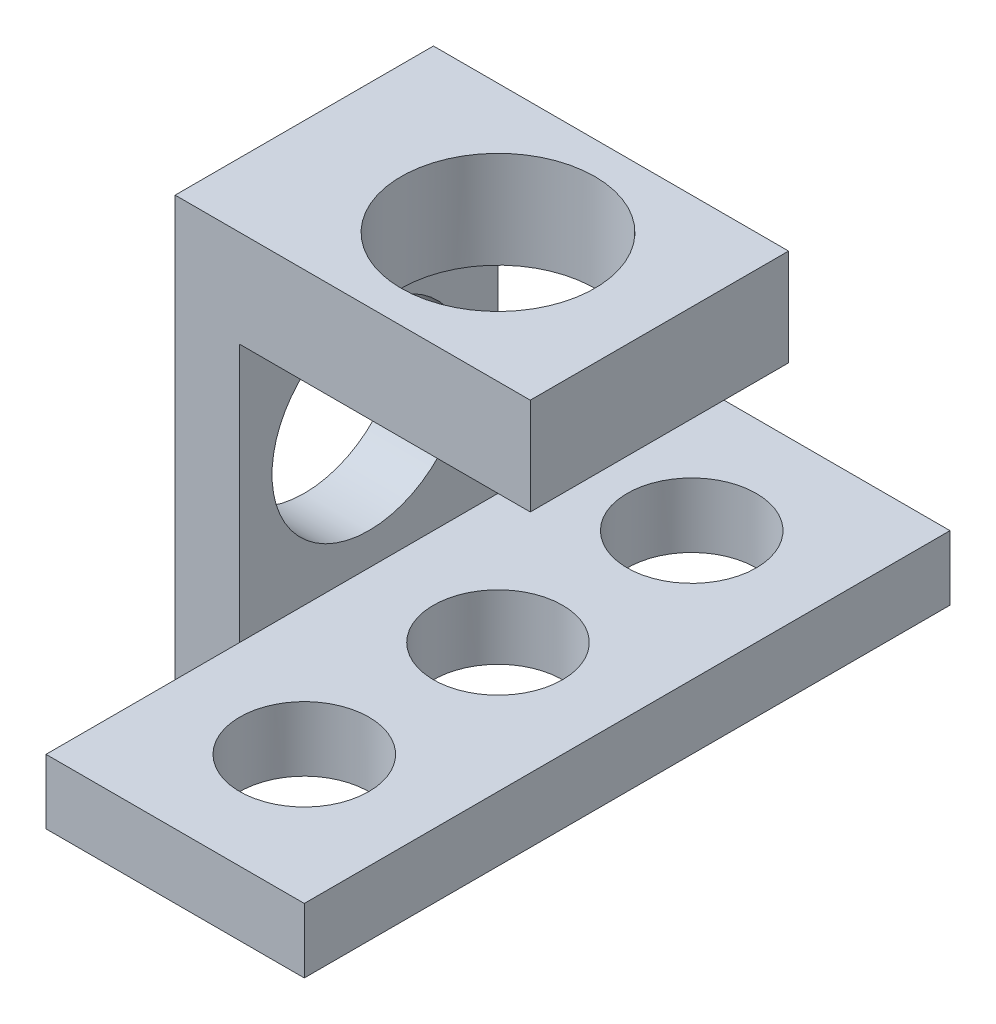
from build123d import *

# Parameters (mm, degrees)
BOSS_EXTRUDE3_DEPTH      = 20
BOSS_EXTRUDE3_DEPTH_BACK = 20
BOSS_EXTRUDE4_DEPTH      = 50
BOSS_EXTRUDE4_DEPTH_BACK = 50
SKETCH1_5_W              = 40
SKETCH1_5_H              = 10
CUT_EXTRUDE2_REACH       = 100.742
SKETCH4_R                = 15
CUT_EXTRUDE3_REACH       = 98.047
SKETCH5_R                = 15
CUT_EXTRUDE4_REACH       = 98.047
SKETCH6_R                = 10


with BuildPart() as part:
    # Sketch1 → Boss-Extrude3 (new, two sides: drawn at the far end of the back side and taken through both)
    with BuildSketch(Plane.XY.offset(-BOSS_EXTRUDE3_DEPTH_BACK)):
        Polygon((5, 65), (-50, 65), (-50, 0), (-40, 0), (-40, 10), (-40, 50), (5, 50), align=None)
    extrude(amount=BOSS_EXTRUDE3_DEPTH + BOSS_EXTRUDE3_DEPTH_BACK)

    # Sketch1<5> → Boss-Extrude4 (add, two sides: drawn at the far end of the back side and taken through both)
    with BuildSketch(Plane.XY.offset(-BOSS_EXTRUDE4_DEPTH_BACK)):
        with Locations((-20, 5)):
            Rectangle(SKETCH1_5_W, SKETCH1_5_H)
    extrude(amount=BOSS_EXTRUDE4_DEPTH + BOSS_EXTRUDE4_DEPTH_BACK)

    # Sketch4 → Cut-Extrude2 (cut, up to next)
    with BuildSketch(Plane.ZY.offset(50), mode=Mode.PRIVATE) as cut_extrude2_sk1:
        with Locations((0, 30)):
            Circle(SKETCH4_R)
    cut_extrude2_tool1 = extrude(cut_extrude2_sk1.sketch, amount=-CUT_EXTRUDE2_REACH, mode=Mode.PRIVATE) & part.part
    add(cut_extrude2_tool1.solids().sort_by_distance((-50, 30, 0))[0], mode=Mode.SUBTRACT)

    # Sketch5 → Cut-Extrude3 (cut, up to next)
    with BuildSketch(Plane(origin=(0, 65, 0), x_dir=(1, 0, 0), z_dir=(0, 1, 0)), mode=Mode.PRIVATE) as cut_extrude3_sk1:
        with Locations((-20, 0)):
            Circle(SKETCH5_R)
    cut_extrude3_tool1 = extrude(cut_extrude3_sk1.sketch, amount=-CUT_EXTRUDE3_REACH, mode=Mode.PRIVATE) & part.part
    add(cut_extrude3_tool1.solids().sort_by_distance((-20, 65, 0))[0], mode=Mode.SUBTRACT)

    # Sketch6 → Cut-Extrude4 (cut, up to next)
    with BuildSketch(Plane.XZ, mode=Mode.PRIVATE) as cut_extrude4_sk1:
        with Locations((-20, 30)):
            Circle(SKETCH6_R)
    cut_extrude4_tool1 = extrude(cut_extrude4_sk1.sketch, amount=-CUT_EXTRUDE4_REACH, mode=Mode.PRIVATE) & part.part
    # Sketch6 → Cut-Extrude4 (cut, up to next)
    with BuildSketch(Plane.XZ, mode=Mode.PRIVATE) as cut_extrude4_sk2:
        with Locations((-20, 0)):
            Circle(SKETCH6_R)
    cut_extrude4_tool2 = extrude(cut_extrude4_sk2.sketch, amount=-CUT_EXTRUDE4_REACH, mode=Mode.PRIVATE) & part.part
    # Sketch6 → Cut-Extrude4 (cut, up to next)
    with BuildSketch(Plane.XZ, mode=Mode.PRIVATE) as cut_extrude4_sk3:
        with Locations((-20, -30)):
            Circle(SKETCH6_R)
    cut_extrude4_tool3 = extrude(cut_extrude4_sk3.sketch, amount=-CUT_EXTRUDE4_REACH, mode=Mode.PRIVATE) & part.part
    add(cut_extrude4_tool1.solids().sort_by_distance((-20, 0, 30))[0], mode=Mode.SUBTRACT)
    add(cut_extrude4_tool2.solids().sort_by_distance((-20, 0, 0))[0], mode=Mode.SUBTRACT)
    add(cut_extrude4_tool3.solids().sort_by_distance((-20, 0, -30))[0], mode=Mode.SUBTRACT)


solid = part.part
